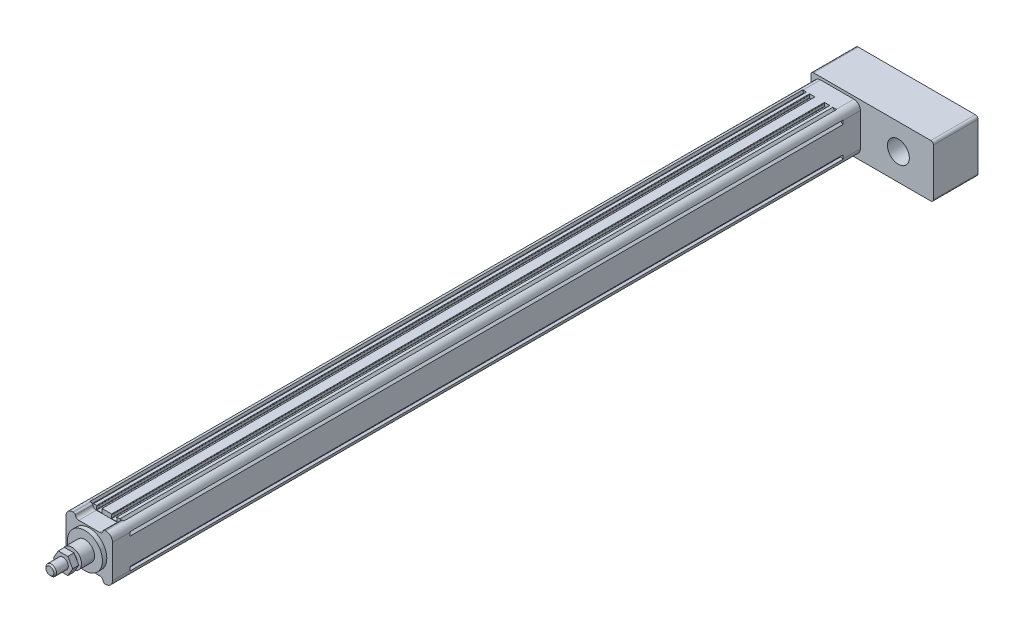
from build123d import *

# Parameters (mm, degrees)
SKETCH_1_R                  = 2.1
EXTRUDE_1_DEPTH             = 815
EXTRUDE_2_DEPTH             = 20
SKETCH_7_R                  = 20
EXTRUDE_3_DEPTH             = 5
SKETCH_9_R                  = 11
EXTRUDE_4_DEPTH             = 15
SKETCH_10_R                 = 6
EXTRUDE_5_DEPTH             = 25
EXTRUDE_START               = 20
EXTRUDE_6_DEPTH             = 20
EXTRUDE_7_DEPTH             = 51
SKETCH_13_R                 = 12.5
CUT_EXTRUDE_2_DEPTH         = 30
PATTERN_LINEAR_1_COUNT      = 2
PATTERN_LINEAR_1_PITCH      = 38
PATTERN_LINEAR_1_COUNT_DIR2 = 2
PATTERN_LINEAR_1_PITCH_DIR2 = 38
HOLE_WIZARD_M6_2_D          = 5
HOLE_WIZARD_M6_2_DEPTH      = 15
HOLE_WIZARD_M6_2_TIP        = 1.502151548
HOLE_WIZARD_M6_3_D          = 5
HOLE_WIZARD_M6_3_DEPTH      = 15
HOLE_WIZARD_M6_3_TIP        = 1.502151548
HOLE_WIZARD_M6_4_D          = 5
HOLE_WIZARD_M6_4_DEPTH      = 15
HOLE_WIZARD_M6_4_TIP        = 1.502151548
CHAMFER_1_SIZE              = 1.5
EXTRUDE_START_2             = 3
EXTRUDE_8_DEPTH             = 7


with BuildPart() as part:
    # 草图1 → 凸台-拉伸1 (new body)
    with BuildSketch(Plane.XY):
        with BuildLine():
            Line((-18.2, 24), (-19.443439638, 26.486879276))
            ThreePointArc((-19.443439638, 26.486879276), (-24.303300859, 24.303300859), (-26.486879276, 19.443439638))
            Line((-26.486879276, 19.443439638), (-24, 18.2))
            Line((-24, 18.2), (-24, 17.1))
            Line((-24, 17.1), (-26.5, 15))
            Line((-26.5, 15), (-26.5, -15))
            Line((-26.5, -15), (-24, -17.1))
            Line((-24, -17.1), (-24, -18.2))
            Line((-24, -18.2), (-26.486879276, -19.443439638))
            ThreePointArc((-26.486879276, -19.443439638), (-24.303300859, -24.303300859), (-19.443439638, -26.486879276))
            Line((-19.443439638, -26.486879276), (-18.2, -24))
            Line((-18.2, -24), (-17.1, -24))
            Line((-17.1, -24), (-15, -26.5))
            Line((-15, -26.5), (-11.65, -26.5))
            ThreePointArc((-11.65, -26.5), (-11.367157288, -26.382842712), (-11.25, -26.1))
            Line((-11.25, -26.1), (-11.25, -25.6))
            ThreePointArc((-11.25, -25.6), (-11.367157288, -25.317157288), (-11.65, -25.2))
            Line((-11.65, -25.2), (-11.75, -25.2))
            Line((-11.75, -25.2), (-11.75, -22.4))
            ThreePointArc((-11.75, -22.4), (-11.632842712, -22.117157288), (-11.35, -22))
            Line((-11.35, -22), (-5.65, -22))
            ThreePointArc((-5.65, -22), (-5.367157288, -22.117157288), (-5.25, -22.4))
            Line((-5.25, -22.4), (-5.25, -25.2))
            Line((-5.25, -25.2), (-5.35, -25.2))
            ThreePointArc((-5.35, -25.2), (-5.632842712, -25.317157288), (-5.75, -25.6))
            Line((-5.75, -25.6), (-5.75, -26.1))
            ThreePointArc((-5.75, -26.1), (-5.632842712, -26.382842712), (-5.35, -26.5))
            Line((-5.35, -26.5), (5.35, -26.5))
            ThreePointArc((5.35, -26.5), (5.632842712, -26.382842712), (5.75, -26.1))
            Line((5.75, -26.1), (5.75, -25.6))
            ThreePointArc((5.75, -25.6), (5.632842712, -25.317157288), (5.35, -25.2))
            Line((5.35, -25.2), (5.25, -25.2))
            Line((5.25, -25.2), (5.25, -22.4))
            ThreePointArc((5.25, -22.4), (5.367157288, -22.117157288), (5.65, -22))
            Line((5.65, -22), (11.35, -22))
            ThreePointArc((11.35, -22), (11.632842712, -22.117157288), (11.75, -22.4))
            Line((11.75, -22.4), (11.75, -25.2))
            Line((11.75, -25.2), (11.65, -25.2))
            ThreePointArc((11.65, -25.2), (11.367157288, -25.317157288), (11.25, -25.6))
            Line((11.25, -25.6), (11.25, -26.1))
            ThreePointArc((11.25, -26.1), (11.367157288, -26.382842712), (11.65, -26.5))
            Line((11.65, -26.5), (15, -26.5))
            Line((15, -26.5), (17.1, -24))
            Line((17.1, -24), (18.2, -24))
            Line((18.2, -24), (19.443439638, -26.486879276))
            ThreePointArc((19.443439638, -26.486879276), (24.303300859, -24.303300859), (26.486879276, -19.443439638))
            Line((26.486879276, -19.443439638), (24, -18.2))
            Line((24, -18.2), (24, -17.1))
            Line((24, -17.1), (26.5, -15))
            Line((26.5, -15), (26.5, 15))
            Line((26.5, 15), (24, 17.1))
            Line((24, 17.1), (24, 18.2))
            Line((24, 18.2), (26.486879276, 19.443439638))
            ThreePointArc((26.486879276, 19.443439638), (24.303300859, 24.303300859), (19.443439638, 26.486879276))
            Line((19.443439638, 26.486879276), (18.2, 24))
            Line((18.2, 24), (17.1, 24))
            Line((17.1, 24), (15, 26.5))
            Line((15, 26.5), (11.65, 26.5))
            ThreePointArc((11.65, 26.5), (11.367157288, 26.382842712), (11.25, 26.1))
            Line((11.25, 26.1), (11.25, 25.6))
            ThreePointArc((11.25, 25.6), (11.367157288, 25.317157288), (11.65, 25.2))
            Line((11.65, 25.2), (11.75, 25.2))
            Line((11.75, 25.2), (11.75, 22.4))
            ThreePointArc((11.75, 22.4), (11.632842712, 22.117157288), (11.35, 22))
            Line((11.35, 22), (5.65, 22))
            ThreePointArc((5.65, 22), (5.367157288, 22.117157288), (5.25, 22.4))
            Line((5.25, 22.4), (5.25, 25.2))
            Line((5.25, 25.2), (5.35, 25.2))
            ThreePointArc((5.35, 25.2), (5.632842712, 25.317157288), (5.75, 25.6))
            Line((5.75, 25.6), (5.75, 26.1))
            ThreePointArc((5.75, 26.1), (5.632842712, 26.382842712), (5.35, 26.5))
            Line((5.35, 26.5), (-5.35, 26.5))
            ThreePointArc((-5.35, 26.5), (-5.632842712, 26.382842712), (-5.75, 26.1))
            Line((-5.75, 26.1), (-5.75, 25.6))
            ThreePointArc((-5.75, 25.6), (-5.632842712, 25.317157288), (-5.35, 25.2))
            Line((-5.35, 25.2), (-5.25, 25.2))
            Line((-5.25, 25.2), (-5.25, 22.4))
            ThreePointArc((-5.25, 22.4), (-5.367157288, 22.117157288), (-5.65, 22))
            Line((-5.65, 22), (-11.35, 22))
            ThreePointArc((-11.35, 22), (-11.632842712, 22.117157288), (-11.75, 22.4))
            Line((-11.75, 22.4), (-11.75, 25.2))
            Line((-11.75, 25.2), (-11.65, 25.2))
            ThreePointArc((-11.65, 25.2), (-11.367157288, 25.317157288), (-11.25, 25.6))
            Line((-11.25, 25.6), (-11.25, 26.1))
            ThreePointArc((-11.25, 26.1), (-11.367157288, 26.382842712), (-11.65, 26.5))
            Line((-11.65, 26.5), (-15, 26.5))
            Line((-15, 26.5), (-17.1, 24))
            Line((-17.1, 24), (-18.2, 24))
        make_face()
        with Locations((19, 19)):
            Circle(SKETCH_1_R, mode=Mode.SUBTRACT)
        with Locations((19, -19)):
            Circle(SKETCH_1_R, mode=Mode.SUBTRACT)
        with Locations((-19, -19)):
            Circle(SKETCH_1_R, mode=Mode.SUBTRACT)
        with Locations((-19, 19)):
            Circle(SKETCH_1_R, mode=Mode.SUBTRACT)
        with BuildLine():
            Line((19.773719933, 3), (23.3, 3))
            Line((23.3, 3), (23.3, -3))
            Line((23.3, -3), (19.773719933, -3))
            ThreePointArc((19.773719933, -3), (0, -20), (-19.773719933, -3))
            Line((-19.773719933, -3), (-23.3, -3))
            Line((-23.3, -3), (-23.3, 3))
            Line((-23.3, 3), (-19.773719933, 3))
            ThreePointArc((-19.773719933, 3), (0, 20), (19.773719933, 3))
        make_face(mode=Mode.SUBTRACT)
    extrude(amount=EXTRUDE_1_DEPTH)

    # 草图6 → 凸台-拉伸2 (add)
    with BuildSketch(Plane.XY.offset(815)):
        with BuildLine():
            Line((-26.5, -19), (-26.5, 19))
            ThreePointArc((-26.5, 19), (-24.303300859, 24.303300859), (-19, 26.5))
            Line((-19, 26.5), (-17.916079783, 26.5))
            ThreePointArc((-17.916079783, 26.5), (-16.625085334, 26.027525232), (-15.944053189, 24.833333333))
            ThreePointArc((-15.944053189, 24.833333333), (-14.581988897, 22.444949537), (-12, 21.5))
            Line((-12, 21.5), (12, 21.5))
            ThreePointArc((12, 21.5), (14.581988897, 22.444949537), (15.944053189, 24.833333333))
            ThreePointArc((15.944053189, 24.833333333), (16.625085334, 26.027525232), (17.916079783, 26.5))
            Line((17.916079783, 26.5), (19, 26.5))
            ThreePointArc((19, 26.5), (24.303300859, 24.303300859), (26.5, 19))
            Line((26.5, 19), (26.5, -19))
            ThreePointArc((26.5, -19), (24.303300859, -24.303300859), (19, -26.5))
            Line((19, -26.5), (17.916079783, -26.5))
            ThreePointArc((17.916079783, -26.5), (16.625085334, -26.027525232), (15.944053189, -24.833333333))
            ThreePointArc((15.944053189, -24.833333333), (14.581988897, -22.444949537), (12, -21.5))
            Line((12, -21.5), (-12, -21.5))
            ThreePointArc((-12, -21.5), (-14.581988897, -22.444949537), (-15.944053189, -24.833333333))
            ThreePointArc((-15.944053189, -24.833333333), (-16.625085334, -26.027525232), (-17.916079783, -26.5))
            Line((-17.916079783, -26.5), (-19, -26.5))
            ThreePointArc((-19, -26.5), (-24.303300859, -24.303300859), (-26.5, -19))
        make_face()
    extrude(amount=EXTRUDE_2_DEPTH)

    # 草图7 → 凸台-拉伸3 (add)
    with BuildSketch(Plane.XY.offset(835)):
        Circle(SKETCH_7_R)
    extrude(amount=EXTRUDE_3_DEPTH)

    # 草图9 → 凸台-拉伸4 (add)
    with BuildSketch(Plane.XY.offset(840)):
        Circle(SKETCH_9_R)
    extrude(amount=EXTRUDE_4_DEPTH)

    # 草图10 → 凸台-拉伸5 (add)
    with BuildSketch(Plane.XY.offset(855)):
        Circle(SKETCH_10_R)
    extrude(amount=EXTRUDE_5_DEPTH)

    # 草图11 → 凸台-拉伸6 (add)
    with BuildSketch(Plane(origin=(0, 0, 0), x_dir=(-1, 0, 0), z_dir=(0, 0, -1)).offset(EXTRUDE_START)):
        with BuildLine():
            Line((-19, -26.5), (19, -26.5))
            ThreePointArc((19, -26.5), (24.303300859, -24.303300859), (26.5, -19))
            Line((26.5, -19), (26.5, 19))
            ThreePointArc((26.5, 19), (24.303300859, 24.303300859), (19, 26.5))
            Line((19, 26.5), (-19, 26.5))
            ThreePointArc((-19, 26.5), (-24.303300859, 24.303300859), (-26.5, 19))
            Line((-26.5, 19), (-26.5, -19))
            ThreePointArc((-26.5, -19), (-24.303300859, -24.303300859), (-19, -26.5))
        make_face()
    extrude(amount=-EXTRUDE_6_DEPTH)

    # 草图12 → 凸台-拉伸7 (add)
    with BuildSketch(Plane(origin=(0, 0, -20), x_dir=(-1, 0, 0), z_dir=(0, 0, -1))):
        with BuildLine():
            Line((-107, -30.404162038), (27, -30.404162038))
            ThreePointArc((27, -30.404162038), (29.121320344, -29.525482382), (30, -27.404162038))
            Line((30, -27.404162038), (30, 26.595837962))
            ThreePointArc((30, 26.595837962), (29.121320344, 28.717158305), (27, 29.595837962))
            Line((27, 29.595837962), (-107, 29.595837962))
            ThreePointArc((-107, 29.595837962), (-109.121320344, 28.717158305), (-110, 26.595837962))
            Line((-110, 26.595837962), (-110, -27.404162038))
            ThreePointArc((-110, -27.404162038), (-109.121320344, -29.525482382), (-107, -30.404162038))
        make_face()
    extrude(amount=EXTRUDE_7_DEPTH)

    # 草图13 → 切除-拉伸2 (cut)
    with BuildSketch(Plane.XY.offset(-20)):
        with Locations((70, 0)):
            Circle(SKETCH_13_R)
    extrude(amount=-CUT_EXTRUDE_2_DEPTH, mode=Mode.SUBTRACT)

    # 草图15 → M6 螺纹孔1 (revolve, cut)
    with BuildSketch(Plane(origin=(-19, -19, -71), x_dir=(0, 1, 0), z_dir=(1, 0, 0))):
        Polygon((0, 0), (0, 16.502151548), (2.5, 15), (2.5, 0), align=None)
    hole_wizard_m6_1 = revolve(axis=Axis((-19, -19, -77.35), (0, 0, 1)), mode=Mode.SUBTRACT)

    # 阵列(线性)1: Hole Wizard M6 _1 2 × 2
    with Locations(*[(j * PATTERN_LINEAR_1_PITCH_DIR2, i * PATTERN_LINEAR_1_PITCH, 0) for i in range(PATTERN_LINEAR_1_COUNT) for j in range(PATTERN_LINEAR_1_COUNT_DIR2) if (i, j) != (0, 0)]):
        add(hole_wizard_m6_1, mode=Mode.SUBTRACT)

    # M6 螺纹孔2
    with Locations(Plane(origin=(0, 0, -71), x_dir=(-1, 0, 0), z_dir=(0, 0, -1))):
        with Locations((-84, -19), (-84, 19)):
            Hole(HOLE_WIZARD_M6_2_D / 2, depth=HOLE_WIZARD_M6_2_DEPTH)
            with Locations((0, 0, -(HOLE_WIZARD_M6_2_DEPTH + HOLE_WIZARD_M6_2_TIP / 2))):  # 118° drill point
                Cone(0, HOLE_WIZARD_M6_2_D / 2, HOLE_WIZARD_M6_2_TIP, mode=Mode.SUBTRACT)

    # M6 螺纹孔3
    with Locations(Plane.ZY.offset(26.5)):
        with Locations((825, 11), (825, -11)):
            Hole(HOLE_WIZARD_M6_3_D / 2, depth=HOLE_WIZARD_M6_3_DEPTH)
            with Locations((0, 0, -(HOLE_WIZARD_M6_3_DEPTH + HOLE_WIZARD_M6_3_TIP / 2))):  # 118° drill point
                Cone(0, HOLE_WIZARD_M6_3_D / 2, HOLE_WIZARD_M6_3_TIP, mode=Mode.SUBTRACT)

    # M6 螺纹孔4
    with Locations(Plane.ZY.offset(26.5)):
        with Locations((-10, 11), (-10, -11)):
            Hole(HOLE_WIZARD_M6_4_D / 2, depth=HOLE_WIZARD_M6_4_DEPTH)
            with Locations((0, 0, -(HOLE_WIZARD_M6_4_DEPTH + HOLE_WIZARD_M6_4_TIP / 2))):  # 118° drill point
                Cone(0, HOLE_WIZARD_M6_4_D / 2, HOLE_WIZARD_M6_4_TIP, mode=Mode.SUBTRACT)

    # 倒角1
    chamfer_1_edges = [part.edges().sort_by_distance(p)[0] for p in [
        (-6, 0, 880),
    ]]
    chamfer(chamfer_1_edges, length=CHAMFER_1_SIZE)

    # 草图23 → 凸台-拉伸8 (add)
    with BuildSketch(Plane.XY.offset(855).offset(EXTRUDE_START_2)):
        Polygon((10.969655115, 0), (5.484827557, 9.5), (-5.484827557, 9.5), (-10.969655115, 0), (-5.484827557, -9.5), (5.484827557, -9.5), align=None)
    extrude(amount=EXTRUDE_8_DEPTH)


solid = part.part
